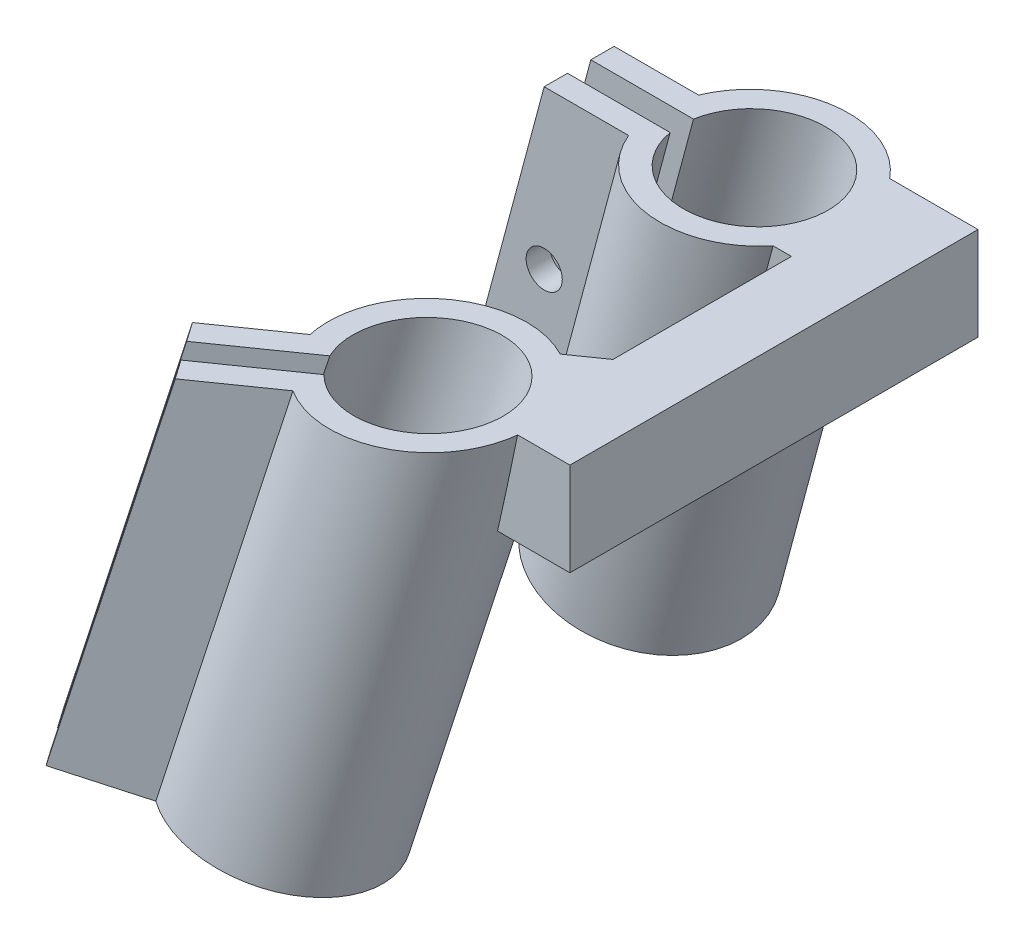
from build123d import *

# Parameters (mm, degrees)
BOSS_EXTRUDE1_DEPTH             = 4
CUT_EXTRUDE2_DEPTH              = 10
BOSS_EXTRUDE2_REACH             = 59.846
BOSS_EXTRUDE2_DIRECTION_2_DEPTH = 28
CUT_EXTRUDE3_DEPTH              = 61.022744116
CUT_EXTRUDE3_DEPTH_BACK         = 61.022744116
SKETCH5_R                       = 1.55
BOSS_EXTRUDE3_DEPTH             = 0.5
CUT_EXTRUDE4_DEPTH              = 53.565024349
BOSS_EXTRUDE4_REACH             = 61.205
BOSS_EXTRUDE4_DIRECTION_2_DEPTH = 28
BOSS_EXTRUDE5_DEPTH             = 0.5


with BuildPart() as part:
    # Sketch1 → Boss-Extrude1 (new, symmetric)
    with BuildSketch(Plane(origin=(0, 0, 0), x_dir=(0, 0, -1), z_dir=(0, 1, 0))):
        Polygon((0, 7.247768223), (0, 0), (35, 0), (35, 10), (25, 10), (25, 6), (9.694351386, 6), (5.918748122, 11.392120275), align=None)
    extrude(amount=BOSS_EXTRUDE1_DEPTH, both=True)

    # Sketch4 → Cut-Extrude2 (cut)
    with BuildSketch(Plane(origin=(0, 0, -35), x_dir=(-1, 0, 0), z_dir=(0, 0, -1))):
        Polygon((10, 4), (7.856406461, 4), (10, -4), align=None)
    extrude(amount=-CUT_EXTRUDE2_DEPTH, mode=Mode.SUBTRACT)

    # Boss-Extrude2: up to this plane
    boss_extrude2_end = Plane(origin=(0, 4, 0), z_dir=(0, 1, 0))
    # Sketch2 → Boss-Extrude2 (add, up to the surface)
    with BuildSketch(Plane(origin=(2.479828187, -7.343959884, 20), x_dir=(-0.96592582628907, 0.25881904510251447, 0), z_dir=(0.25881904510251447, 0.96592582628907, 0)), mode=Mode.PRIVATE) as boss_extrude2_sk1:
        with BuildLine():
            Line((25.037543411, -49), (33.54403058, -49))
            Line((33.54403058, -49), (33.54403058, -47))
            Line((33.54403058, -47), (26.54403058, -47))
            ThreePointArc((26.54403058, -47), (10.920068858, -50), (26.54403058, -53))
            Line((26.54403058, -53), (33.54403058, -53))
            Line((33.54403058, -53), (33.54403058, -51))
            Line((33.54403058, -51), (25.037543411, -51))
            ThreePointArc((25.037543411, -51), (12.920068858, -50), (25.037543411, -49))
        make_face()
    boss_extrude2_tool1 = split(extrude(boss_extrude2_sk1.sketch, amount=BOSS_EXTRUDE2_REACH, mode=Mode.PRIVATE), bisect_by=boss_extrude2_end, keep=Keep.BOTH, mode=Mode.PRIVATE)
    add(boss_extrude2_tool1.solids().sort_by_distance((-25.812899, 0.237054, -28.72174))[0])

    # Sketch2 → Boss-Extrude2 direction 2 (add)
    with BuildSketch(Plane(origin=(2.479828187, -7.343959884, 20), x_dir=(-0.96592582628907, 0.25881904510251447, 0), z_dir=(0.25881904510251447, 0.96592582628907, 0))):
        with BuildLine():
            Line((25.037543411, -49), (33.54403058, -49))
            Line((33.54403058, -49), (33.54403058, -47))
            Line((33.54403058, -47), (26.54403058, -47))
            ThreePointArc((26.54403058, -47), (10.920068858, -50), (26.54403058, -53))
            Line((26.54403058, -53), (33.54403058, -53))
            Line((33.54403058, -53), (33.54403058, -51))
            Line((33.54403058, -51), (25.037543411, -51))
            ThreePointArc((25.037543411, -51), (12.920068858, -50), (25.037543411, -49))
        make_face()
    extrude(amount=-BOSS_EXTRUDE2_DIRECTION_2_DEPTH)

    # Sketch5 → Cut-Extrude3 (cut, two sides: drawn at the far end of the back side and taken through both)
    with BuildSketch(Plane(origin=(0, 0, -35), x_dir=(-1, 0, 0), z_dir=(0, 0, -1)).offset(-CUT_EXTRUDE3_DEPTH_BACK)):
        with Locations((29.206205162, -9.547072736)):
            Circle(SKETCH5_R)
    extrude(amount=CUT_EXTRUDE3_DEPTH + CUT_EXTRUDE3_DEPTH_BACK, mode=Mode.SUBTRACT)

    # Sketch7 → Boss-Extrude3 (add)
    with BuildSketch(Plane(origin=(-8.916806244, -33.277973944, 0), x_dir=(-0.96592582628907, 0.2588190451025145, 0), z_dir=(0.2588190451025145, 0.96592582628907, 0))):
        with BuildLine():
            Line((20.944110699, -29), (19.724981983, -29))
            ThreePointArc((19.724981983, -29), (9.623982082, -30), (19.724981983, -31))
            Line((19.724981983, -31), (20.944110699, -31))
            ThreePointArc((20.944110699, -31), (8.423982082, -30), (20.944110699, -29))
        make_face()
    extrude(amount=BOSS_EXTRUDE3_DEPTH)

    # Sketch8 → Cut-Extrude4 (cut, through all)
    with BuildSketch(Plane(origin=(-6.5287948, 0, -9.32408528), x_dir=(-0.819152044288991, 0, 0.5735764363510473), z_dir=(-0.5735764363510473, 0, -0.819152044288991))):
        Polygon((5.937024156, 4), (5.937024156, -4), (3.793430617, 4), align=None)
    extrude(amount=-CUT_EXTRUDE4_DEPTH, mode=Mode.SUBTRACT)

    # Boss-Extrude4: up to this plane
    boss_extrude4_end = Plane(origin=(0, 4, 0), z_dir=(0, 1, 0))
    # Sketch9 → Boss-Extrude4 (add, up to the surface)
    with BuildSketch(Plane(origin=(-1.144933078, -5.216306847, 0.801690772), x_dir=(-0.5735764363510472, 0, -0.819152044288991), z_dir=(0.21201214989664938, 0.96592582628907, -0.14845250554968126)), mode=Mode.PRIVATE) as boss_extrude4_sk1:
        with BuildLine():
            Line((6.769877721, 16.816923337), (6.769877721, 25.323410506))
            Line((6.769877721, 25.323410506), (4.769877721, 25.323410506))
            Line((4.769877721, 25.323410506), (4.769877721, 18.323410506))
            ThreePointArc((4.769877721, 18.323410506), (7.769877721, 2.699448783), (10.769877721, 18.323410506))
            Line((10.769877721, 18.323410506), (10.769877721, 25.323410506))
            Line((10.769877721, 25.323410506), (8.769877721, 25.323410506))
            Line((8.769877721, 25.323410506), (8.769877721, 16.816923337))
            ThreePointArc((8.769877721, 16.816923337), (7.769877721, 4.699448783), (6.769877721, 16.816923337))
        make_face()
    boss_extrude4_tool1 = split(extrude(boss_extrude4_sk1.sketch, amount=BOSS_EXTRUDE4_REACH, mode=Mode.PRIVATE), bisect_by=boss_extrude4_end, keep=Keep.BOTH, mode=Mode.PRIVATE)
    add(boss_extrude4_tool1.solids().sort_by_distance((-21.539934, 0.237054, 7.157621))[0])

    # Sketch9 → Boss-Extrude4 direction 2 (add)
    with BuildSketch(Plane(origin=(-1.144933078, -5.216306847, 0.801690772), x_dir=(-0.5735764363510472, 0, -0.819152044288991), z_dir=(0.21201214989664938, 0.96592582628907, -0.14845250554968126))):
        with BuildLine():
            Line((6.769877721, 16.816923337), (6.769877721, 25.323410506))
            Line((6.769877721, 25.323410506), (4.769877721, 25.323410506))
            Line((4.769877721, 25.323410506), (4.769877721, 18.323410506))
            ThreePointArc((4.769877721, 18.323410506), (7.769877721, 2.699448783), (10.769877721, 18.323410506))
            Line((10.769877721, 18.323410506), (10.769877721, 25.323410506))
            Line((10.769877721, 25.323410506), (8.769877721, 25.323410506))
            Line((8.769877721, 25.323410506), (8.769877721, 16.816923337))
            ThreePointArc((8.769877721, 16.816923337), (7.769877721, 4.699448783), (6.769877721, 16.816923337))
        make_face()
    extrude(amount=-BOSS_EXTRUDE4_DIRECTION_2_DEPTH)

    # Sketch10 → Boss-Extrude5 (add)
    with BuildSketch(Plane(origin=(-7.081273275, -32.262229983, 4.958360927), x_dir=(0.9766546875566917, -0.2147970934280116, -0.0027982009254068387), z_dir=(-0.21201214989664938, -0.96592582628907, 0.14845250554968126))):
        with BuildLine():
            Line((-16.465765356, 2.911480582), (-17.901629513, 3.876715105))
            ThreePointArc((-17.901629513, 3.876715105), (-8.068915493, -3.938101309), (-19.017417439, 2.216890625))
            Line((-19.017417439, 2.216890625), (-17.581553282, 1.251656102))
            ThreePointArc((-17.581553282, 1.251656102), (-9.479766301, -2.989681571), (-16.465765356, 2.911480582))
        make_face()
    extrude(amount=-BOSS_EXTRUDE5_DEPTH)


solid = part.part
